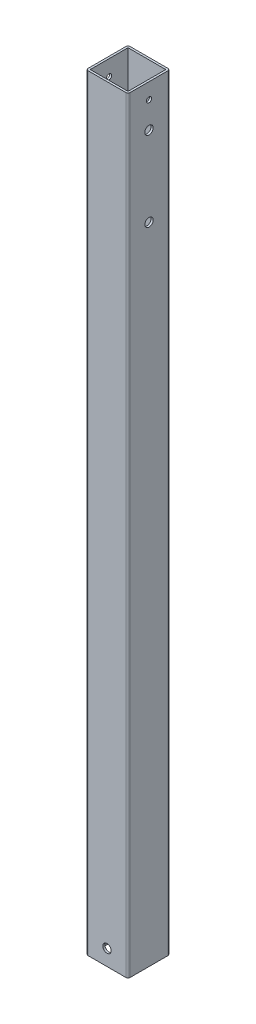
from build123d import *

# Parameters (mm, degrees)
SKETCH1_W                      = 36
SKETCH1_H                      = 36
EXTRUDE_THIN1_DEPTH            = 730
CUT_EXTRUDE1_REACH             = 734.189
SKETCH2_R                      = 4
CUT_EXTRUDE1_DIRECTION_2_DEPTH = 733.188500319
CUT_EXTRUDE4_REACH             = 734.189
SKETCH5_R                      = 2.5
CUT_EXTRUDE6_REACH             = 734.189
SKETCH6_R                      = 4


with BuildPart() as part:
    # Sketch1 → Extrude-Thin1 (new body)
    with BuildSketch(Plane(origin=(0, 0, 0), x_dir=(1, 0, 0), z_dir=(0, 1, 0))):
        with BuildLine():
            Line((2, 0), (38, 0))
            ThreePointArc((38, 0), (39.414213562, -0.585786438), (40, -2))
            Line((40, -2), (40, -38))
            ThreePointArc((40, -38), (39.414213562, -39.414213562), (38, -40))
            Line((38, -40), (2, -40))
            ThreePointArc((2, -40), (0.585786438, -39.414213562), (0, -38))
            Line((0, -38), (0, -2))
            ThreePointArc((0, -2), (0.585786438, -0.585786438), (2, 0))
        make_face()
        with Locations((20, -20)):
            Rectangle(SKETCH1_W, SKETCH1_H, mode=Mode.SUBTRACT)
    extrude(amount=EXTRUDE_THIN1_DEPTH)

    # Cut-Extrude1: up to this face of the body (flat: up to its plane)
    cut_extrude1_end = Plane(part.part.faces().sort_by_distance((20, 365, 0))[0])
    # Sketch2 → Cut-Extrude1 (cut, up to the picked face)
    with BuildSketch(Plane.XY.offset(40), mode=Mode.PRIVATE) as cut_extrude1_sk1:
        with Locations((20, 15)):
            Circle(SKETCH2_R)
    cut_extrude1_tool1 = split(extrude(cut_extrude1_sk1.sketch, amount=-CUT_EXTRUDE1_REACH, mode=Mode.PRIVATE), bisect_by=cut_extrude1_end, keep=Keep.BOTH, mode=Mode.PRIVATE)
    add(cut_extrude1_tool1.solids().sort_by(Axis((20, 15, 40), (0, 0, -1)))[0], mode=Mode.SUBTRACT)

    # Sketch2 → Cut-Extrude1 direction 2 (cut)
    with BuildSketch(Plane.XY.offset(40)):
        with Locations((20, 15)):
            Circle(SKETCH2_R)
    extrude(amount=CUT_EXTRUDE1_DIRECTION_2_DEPTH, mode=Mode.SUBTRACT)

    # Cut-Extrude4: up to this face of the body (flat: up to its plane)
    cut_extrude4_end = Plane(part.part.faces().sort_by_distance((40, 365, 20))[0])
    # Sketch5 → Cut-Extrude4 (cut, up to the picked face)
    with BuildSketch(Plane.ZY, mode=Mode.PRIVATE) as cut_extrude4_sk1:
        with Locations((20, 715)):
            Circle(SKETCH5_R)
    cut_extrude4_tool1 = split(extrude(cut_extrude4_sk1.sketch, amount=-CUT_EXTRUDE4_REACH, mode=Mode.PRIVATE), bisect_by=cut_extrude4_end, keep=Keep.BOTH, mode=Mode.PRIVATE)
    add(cut_extrude4_tool1.solids().sort_by(Axis((0, 715, 20), (1, 0, 0)))[0], mode=Mode.SUBTRACT)

    # Cut-Extrude6: up to this face of the body (flat: up to its plane)
    cut_extrude6_end = Plane(part.part.faces().sort_by_distance((0, 364.738303945, 20))[0])
    # Sketch6 → Cut-Extrude6 (cut, up to the picked face)
    with BuildSketch(Plane(origin=(40, 0, 0), x_dir=(0, 0, -1), z_dir=(1, 0, 0)), mode=Mode.PRIVATE) as cut_extrude6_sk1:
        with Locations((-20, 690)):
            Circle(SKETCH6_R)
    cut_extrude6_tool1 = split(extrude(cut_extrude6_sk1.sketch, amount=-CUT_EXTRUDE6_REACH, mode=Mode.PRIVATE), bisect_by=cut_extrude6_end, keep=Keep.BOTH, mode=Mode.PRIVATE)
    # Sketch6 → Cut-Extrude6 (cut, up to the picked face)
    with BuildSketch(Plane(origin=(40, 0, 0), x_dir=(0, 0, -1), z_dir=(1, 0, 0)), mode=Mode.PRIVATE) as cut_extrude6_sk2:
        with Locations((-20, 614)):
            Circle(SKETCH6_R)
    cut_extrude6_tool2 = split(extrude(cut_extrude6_sk2.sketch, amount=-CUT_EXTRUDE6_REACH, mode=Mode.PRIVATE), bisect_by=cut_extrude6_end, keep=Keep.BOTH, mode=Mode.PRIVATE)
    add(cut_extrude6_tool1.solids().sort_by(Axis((40, 690, 20), (-1, 0, 0)))[0], mode=Mode.SUBTRACT)
    add(cut_extrude6_tool2.solids().sort_by(Axis((40, 614, 20), (-1, 0, 0)))[0], mode=Mode.SUBTRACT)


solid = part.part
